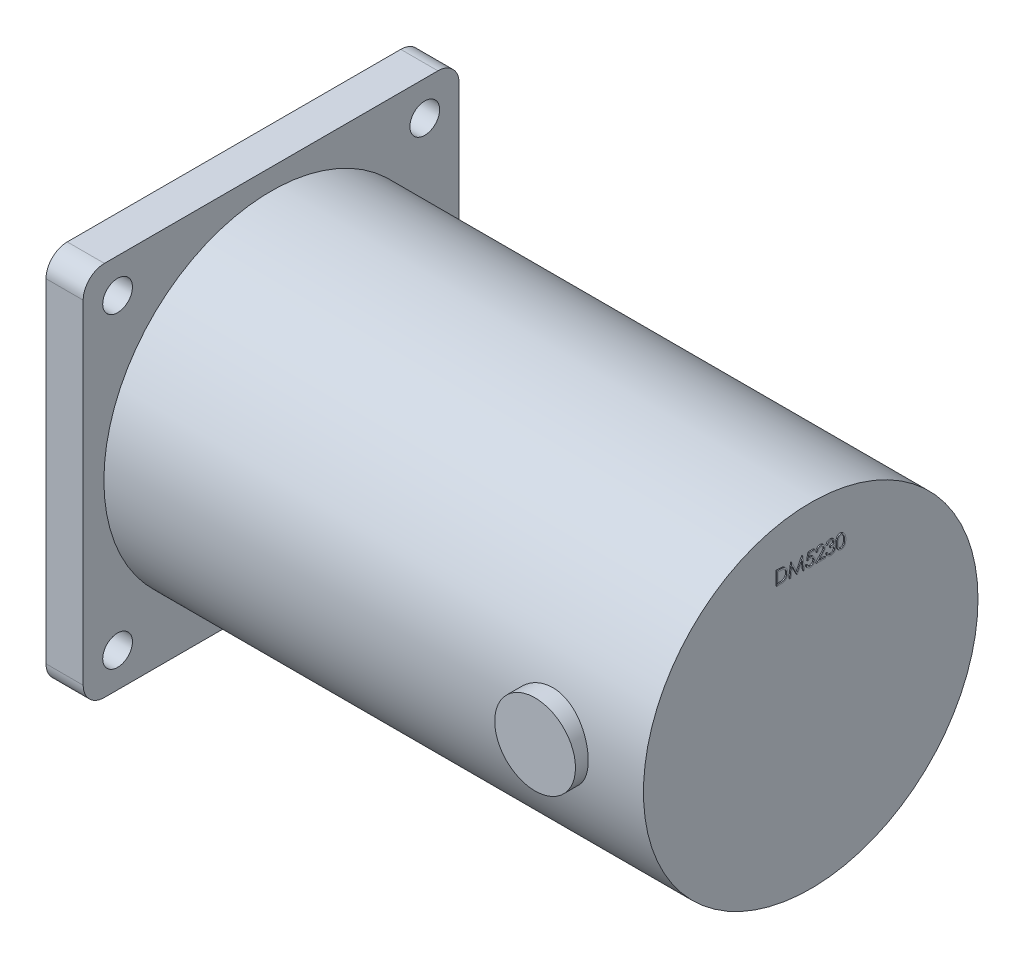
from build123d import *

# Parameters (mm, degrees)
SKETCH1_R           = 40.005
BOSS_EXTRUDE1_DEPTH = 129.032
SKETCH2_W           = 89.916
SKETCH2_H           = 89.916
BOSS_EXTRUDE2_DEPTH = 8.89
FILLET1_R           = 5.08
SKETCH3_R           = 41.529
BOSS_EXTRUDE3_DEPTH = 2
CUT_EXTRUDE4_REACH  = 153.871
SKETCH4_R           = 3.556
CIRPATTERN1_COUNT   = 4
SKETCH6_R           = 5
BOSS_EXTRUDE4_DEPTH = 29.5
BOSS_EXTRUDE5_DEPTH = 4
SKETCH8_R           = 9.652
BOSS_EXTRUDE6_DEPTH = 3.048
BOSS_EXTRUDE7_DEPTH = 0.254


with BuildPart() as part:
    # Sketch1 → Boss-Extrude1 (new body)
    with BuildSketch(Plane(origin=(0, 0, 0), x_dir=(0, 0, -1), z_dir=(1, 0, 0))):
        Circle(SKETCH1_R)
    extrude(amount=-BOSS_EXTRUDE1_DEPTH)

    # Sketch2 → Boss-Extrude2 (add)
    with BuildSketch(Plane.ZY.offset(129.032)):
        Rectangle(SKETCH2_W, SKETCH2_H)
    extrude(amount=BOSS_EXTRUDE2_DEPTH)

    # Fillet1
    fillet1_edges = [part.edges().sort_by_distance(p)[0] for p in [
        (-133.477, -44.958, 44.958),
        (-133.477, 44.958, 44.958),
        (-133.477, 44.958, -44.958),
        (-133.477, -44.958, -44.958),
    ]]
    fillet(fillet1_edges, radius=FILLET1_R)

    # Sketch3 → Boss-Extrude3 (add)
    with BuildSketch(Plane.ZY.offset(137.922)):
        Circle(SKETCH3_R)
    extrude(amount=BOSS_EXTRUDE3_DEPTH)

    # Sketch4 → Cut-Extrude4 (cut, up to next)
    with BuildSketch(Plane.ZY.offset(137.922), mode=Mode.PRIVATE) as cut_extrude4_sk1:
        with Locations((36.729247535, 36.729247535)):
            Circle(SKETCH4_R)
    cut_extrude4_tool1 = extrude(cut_extrude4_sk1.sketch, amount=-CUT_EXTRUDE4_REACH, mode=Mode.PRIVATE) & part.part
    cut_extrude4 = cut_extrude4_tool1.solids().sort_by_distance((-137.922, 36.729248, 36.729248))[0]
    add(cut_extrude4, mode=Mode.SUBTRACT)

    # CirPattern1: Cut-Extrude4 ×4 about axis
    cirpattern1_axis = Axis((0, 0, 0), (1, 0, 0))
    for i in range(1, CIRPATTERN1_COUNT):
        add(cut_extrude4.rotate(cirpattern1_axis, i * 360 / CIRPATTERN1_COUNT), mode=Mode.SUBTRACT)

    # Sketch6 → Boss-Extrude4 (add)
    with BuildSketch(Plane.ZY.offset(139.922)):
        with Locations(Location((0, 0, 0), (0, 0, 180))):
            Circle(SKETCH6_R)
    extrude(amount=BOSS_EXTRUDE4_DEPTH)

    # Sketch7 → Boss-Extrude5 (add)
    with BuildSketch(Plane(origin=(0, 2.660396, 0), x_dir=(1, 0, 0), z_dir=(0, 1, 0))):
        with BuildLine():
            Line((-169.422, 2.03121056), (-128.012686032, 2.03121056))
            ThreePointArc((-128.012686032, 2.03121056), (-135.661867848, -9.655707426), (-147.324, -1.96878944))
            Line((-147.324, -1.96878944), (-169.422, -1.96878944))
            Line((-169.422, -1.96878944), (-169.422, 2.03121056))
        make_face()
    extrude(amount=BOSS_EXTRUDE5_DEPTH)

    # Sketch8 → Boss-Extrude6 (add, symmetric)
    with BuildSketch(Plane.XY.offset(40.005)):
        with Locations((-22.86, 0)):
            Circle(SKETCH8_R)
    boss_extrude6 = extrude(amount=BOSS_EXTRUDE6_DEPTH, both=True)

    # Mirror1: Boss-Extrude6 across plane
    add(boss_extrude6.mirror(Plane.XY))

    # Sketch10 → Boss-Extrude7 (add)
    # profile 1 of 6: a face of its own
    with BuildSketch(Plane(origin=(0, 0, 0), x_dir=(0, 0, -1), z_dir=(1, 0, 0))):
        with BuildLine():
            Line((-8.336390827, 26.927418213), (-8.336390827, 30.102418213))
            Line((-8.336390827, 30.102418213), (-7.695285057, 30.102418213))
            add(Edge.make_bspline(
                [(-7.695285057, 30.102418213), (-7.639523904, 30.102016739), (-7.531793645, 30.101241093), (-7.376116639, 30.096323116), (-7.232077083, 30.087623194), (-7.100148704, 30.074950838), (-6.979969319, 30.059390586), (-6.871875439, 30.039886648), (-6.775308138, 30.01685595), (-6.715918002, 29.997220435), (-6.687833134, 29.98793504)],
                knots=[0, 0, 0, 0, 1.314313732, 2.53924729, 3.670748893, 4.714932338, 5.66265055, 6.526160246, 7.303039223, 8, 8, 8, 8], degree=3))
            add(Edge.make_bspline(
                [(-6.687833134, 29.98793504), (-6.651098621, 29.973937186), (-6.578462611, 29.946258902), (-6.475041864, 29.894047114), (-6.377682427, 29.834889515), (-6.285862203, 29.768708125), (-6.201678596, 29.693629037), (-6.121842861, 29.612841538), (-6.049620933, 29.52340783), (-5.983482693, 29.427182662), (-5.923851059, 29.325299586), (-5.872017681, 29.217952737), (-5.828970129, 29.10568727), (-5.793234845, 28.988815386), (-5.765071273, 28.8670801), (-5.745856235, 28.740339665), (-5.733182551, 28.609094971), (-5.731908876, 28.520036708), (-5.731262622, 28.474849102)],
                knots=[0, 0, 0, 0, 0.984719456, 1.947108742, 2.898477687, 3.838006223, 4.779231079, 5.722358779, 6.681677486, 7.655904652, 8.64651281, 9.637519902, 10.640069247, 11.656948941, 12.698408672, 13.768548281, 14.867775369, 16, 16, 16, 16], degree=3))
            add(Edge.make_bspline(
                [(-5.731262622, 28.474849102), (-5.731833185, 28.435604979), (-5.73295754, 28.358270335), (-5.743053419, 28.244296094), (-5.757727652, 28.133703068), (-5.780446317, 28.027017897), (-5.80802574, 27.923305871), (-5.843371792, 27.823672335), (-5.883862563, 27.727203308), (-5.931079239, 27.635203169), (-5.982914638, 27.548041825), (-6.038542219, 27.465876881), (-6.09790265, 27.389880787), (-6.161561974, 27.319823403), (-6.228697546, 27.255810343), (-6.299748903, 27.197306872), (-6.374899385, 27.145457711), (-6.453812397, 27.098225406), (-6.538790029, 27.057022655), (-6.63144185, 27.022161146), (-6.73216299, 26.993271716), (-6.840706223, 26.969168118), (-6.957259092, 26.950047994), (-7.081935868, 26.937233338), (-7.214544995, 26.928567463), (-7.305603328, 26.927808735), (-7.352471556, 26.927418213)],
                knots=[0, 0, 0, 0, 1.105936401, 2.179363191, 3.223086493, 4.248585256, 5.251745608, 6.245858792, 7.225916811, 8.198733463, 9.158002045, 10.082870192, 10.993790845, 11.873723703, 12.748670949, 13.606408763, 14.465103618, 15.319838547, 16.196477973, 17.123216899, 18.106603292, 19.147568657, 20.255746949, 21.433717677, 22.679120308, 24, 24, 24, 24], degree=3))
            Line((-7.352471556, 26.927418213), (-8.336390827, 26.927418213))
        make_face()
        with BuildLine():
            Line((-8.051454929, 27.253059239), (-7.687016828, 27.253059239))
            add(Edge.make_bspline(
                [(-7.687016828, 27.253059239), (-7.634648949, 27.253284298), (-7.533926339, 27.253717168), (-7.389093727, 27.25751556), (-7.256760275, 27.263722174), (-7.136907191, 27.272408138), (-7.029602148, 27.283900381), (-6.934620889, 27.296713686), (-6.852274762, 27.312677088), (-6.802445915, 27.327146887), (-6.779419673, 27.333833477)],
                knots=[0, 0, 0, 0, 1.375205317, 2.645023457, 3.804390687, 4.853969522, 5.800190428, 6.637939096, 7.370582563, 8, 8, 8, 8], degree=3))
            add(Edge.make_bspline(
                [(-6.779419673, 27.333833477), (-6.750437944, 27.344040248), (-6.693166715, 27.364210001), (-6.610724588, 27.401001594), (-6.533837877, 27.444582614), (-6.46116664, 27.493026105), (-6.393741745, 27.548040693), (-6.330764154, 27.60843009), (-6.272360663, 27.674501636), (-6.219134683, 27.746173325), (-6.17150215, 27.822999069), (-6.130253249, 27.904223582), (-6.094102217, 27.988956903), (-6.065728065, 28.078500211), (-6.043488928, 28.172053), (-6.027736675, 28.26962185), (-6.017926175, 28.371188542), (-6.016781862, 28.440269397), (-6.016198519, 28.47548512)],
                knots=[0, 0, 0, 0, 0.998632004, 1.973411704, 2.929992603, 3.868527914, 4.809262121, 5.754881198, 6.702106254, 7.672490631, 8.653608572, 9.636854334, 10.631411391, 11.644891563, 12.686317036, 13.754757253, 14.855430412, 16, 16, 16, 16], degree=3))
            add(Edge.make_bspline(
                [(-6.016198519, 28.47548512), (-6.016664144, 28.512617634), (-6.017578868, 28.585564787), (-6.029076278, 28.692599204), (-6.045877975, 28.795542365), (-6.070174605, 28.894401157), (-6.101136188, 28.989368448), (-6.139775613, 29.079919003), (-6.183923189, 29.167009134), (-6.236449787, 29.248628738), (-6.29397679, 29.325820344), (-6.35781958, 29.396536589), (-6.426963858, 29.460938561), (-6.500655471, 29.520029223), (-6.580971269, 29.571431272), (-6.66601926, 29.617411333), (-6.757047118, 29.656432891), (-6.820377207, 29.677187288), (-6.8525617, 29.687734719)],
                knots=[0, 0, 0, 0, 1.122418816, 2.205001699, 3.251619955, 4.274784885, 5.280384055, 6.268708349, 7.249350384, 8.229342522, 9.199999885, 10.157847722, 11.105861043, 12.055065948, 13.010012805, 13.98527497, 14.976112212, 16, 16, 16, 16], degree=3))
            add(Edge.make_bspline(
                [(-6.8525617, 29.687734719), (-6.879187383, 29.695097479), (-6.93580089, 29.710752726), (-7.028183832, 29.727830028), (-7.132156146, 29.742892681), (-7.248179447, 29.755645331), (-7.376121477, 29.764795972), (-7.516080637, 29.771664236), (-7.668117421, 29.776296681), (-7.773511577, 29.776613009), (-7.828212742, 29.776777187)],
                knots=[0, 0, 0, 0, 0.674548936, 1.434276114, 2.292660221, 3.240891867, 4.284742987, 5.42552168, 6.663806718, 8, 8, 8, 8], degree=3))
            Line((-7.828212742, 29.776777187), (-8.051454929, 29.776777187))
            Line((-8.051454929, 29.776777187), (-8.051454929, 27.253059239))
        make_face(mode=Mode.SUBTRACT)
    # profile 2 of 6: a face of its own
    with BuildSketch(Plane(origin=(0, 0, 0), x_dir=(0, 0, -1), z_dir=(1, 0, 0))):
        Polygon((-5.242801083, 26.927418213), (-4.823665466, 30.102418213), (-4.782960338, 30.102418213), (-3.472128006, 27.497290008), (-2.164475763, 30.102418213), (-2.123134617, 30.102418213), (-1.701454929, 26.927418213), (-1.987662862, 26.927418213), (-2.291679288, 29.211993534), (-3.437783054, 26.927418213), (-3.502020835, 26.927418213), (-4.652576724, 29.217081675), (-4.955957133, 26.927418213), align=None)
    # profile 3 of 6: a face of its own
    with BuildSketch(Plane(origin=(0, 0, 0), x_dir=(0, 0, -1), z_dir=(1, 0, 0))):
        with BuildLine():
            Line((0.659442507, 30.102418213), (0.659442507, 29.776777187))
            Line((0.659442507, 29.776777187), (-0.420515426, 29.776777187))
            Line((-0.420515426, 29.776777187), (-0.591604168, 28.941686042))
            add(Edge.make_bspline(
                [(-0.591604168, 28.941686042), (-0.557989196, 28.95096636), (-0.492865505, 28.968945508), (-0.396744774, 28.988907885), (-0.305493275, 29.000941538), (-0.246279189, 29.002584656), (-0.217625803, 29.003379751)],
                knots=[0, 0, 0, 0, 1.100273476, 2.13160584, 3.095893838, 4, 4, 4, 4], degree=3))
            add(Edge.make_bspline(
                [(-0.217625803, 29.003379751), (-0.182171267, 29.002612367), (-0.112458793, 29.001103497), (-0.010460605, 28.986614748), (0.086905662, 28.963809254), (0.179436384, 28.931949924), (0.267302741, 28.89121038), (0.349696314, 28.84031972), (0.42785385, 28.780871627), (0.500373203, 28.712522937), (0.566163111, 28.637301185), (0.624007973, 28.556422259), (0.67314118, 28.470672165), (0.712657007, 28.379231613), (0.744211368, 28.283111524), (0.765213535, 28.181300538), (0.779198692, 28.074758315), (0.780761142, 28.001910598), (0.781557891, 27.964762965)],
                knots=[0, 0, 0, 0, 1.052922333, 2.070308379, 3.05430497, 4.020497103, 4.973039431, 5.925935799, 6.892292201, 7.88610001, 8.88166317, 9.857072816, 10.836096531, 11.812156883, 12.81219415, 13.836441305, 14.89672472, 16, 16, 16, 16], degree=3))
            add(Edge.make_bspline(
                [(0.781557891, 27.964762965), (0.780954573, 27.938889236), (0.77975609, 27.88749144), (0.773661371, 27.81116063), (0.761926829, 27.736445774), (0.746171822, 27.663336961), (0.725722628, 27.591972602), (0.700967558, 27.522148431), (0.67067259, 27.454299037), (0.6374427, 27.387782429), (0.600026252, 27.324102355), (0.558498606, 27.264549345), (0.514624196, 27.208230033), (0.467415225, 27.155748432), (0.416432894, 27.107449409), (0.362294638, 27.063046325), (0.305432457, 27.021788261), (0.24496663, 26.98534997), (0.182244521, 26.951819288), (0.116360352, 26.924311508), (0.04881386, 26.899718386), (-0.021367135, 26.880115457), (-0.094023665, 26.864755211), (-0.169275497, 26.854322524), (-0.246727962, 26.846723898), (-0.299228866, 26.846248231), (-0.325748799, 26.846007957)],
                knots=[0, 0, 0, 0, 1.056347294, 2.098418968, 3.122841568, 4.141288669, 5.149314143, 6.15115421, 7.162517403, 8.180376062, 9.185164535, 10.17417709, 11.141909838, 12.097768115, 13.052685741, 14.0056014, 14.954263652, 15.917497458, 16.885230207, 17.854509472, 18.828990115, 19.81800267, 20.826176721, 21.857883937, 22.917946725, 24, 24, 24, 24], degree=3))
            add(Edge.make_bspline(
                [(-0.325748799, 26.846007957), (-0.357384663, 26.846634645), (-0.419624488, 26.847867581), (-0.510811003, 26.860765779), (-0.598544966, 26.87923876), (-0.68212013, 26.907030233), (-0.76228549, 26.941852994), (-0.837961813, 26.985864092), (-0.911082767, 27.035737993), (-0.978675829, 27.094593742), (-1.041410303, 27.158924396), (-1.09756835, 27.228735971), (-1.147582381, 27.302876251), (-1.19065148, 27.38170529), (-1.227388971, 27.465015958), (-1.25624971, 27.553120394), (-1.279543646, 27.645558255), (-1.289398321, 27.709197511), (-1.294403647, 27.741520777)],
                knots=[0, 0, 0, 0, 1.0467383, 2.05933395, 3.04377827, 4.011590433, 4.970194871, 5.932262533, 6.905835911, 7.896367577, 8.894135286, 9.877477877, 10.858688626, 11.851381753, 12.8477658, 13.868841284, 14.917554742, 16, 16, 16, 16], degree=3))
            Line((-1.294403647, 27.741520777), (-1.00946775, 27.741520777))
            add(Edge.make_bspline(
                [(-1.00946775, 27.741520777), (-1.002456844, 27.711243567), (-0.988981494, 27.653049087), (-0.959403422, 27.571287085), (-0.923239378, 27.498426074), (-0.880236862, 27.433502238), (-0.828937906, 27.376888362), (-0.770400495, 27.326435742), (-0.704770775, 27.280919731), (-0.631842631, 27.242980507), (-0.554905052, 27.210623852), (-0.474380511, 27.189077672), (-0.392461568, 27.173927576), (-0.337054761, 27.17241105), (-0.309212341, 27.171648982)],
                knots=[0, 0, 0, 0, 1.136247022, 2.183929868, 3.172523383, 4.106158343, 5.02341133, 5.958108904, 6.928429099, 7.938127109, 8.96079061, 9.975095812, 10.982467395, 12, 12, 12, 12], degree=3))
            add(Edge.make_bspline(
                [(-0.309212341, 27.171648982), (-0.282035752, 27.172393545), (-0.228524826, 27.173859595), (-0.149774497, 27.185143556), (-0.073744247, 27.20252221), (-0.001184287, 27.228529864), (0.069175109, 27.260139002), (0.135554172, 27.300701963), (0.199873211, 27.347383552), (0.260133018, 27.400865637), (0.31532309, 27.459802432), (0.364087571, 27.522828353), (0.404706628, 27.590062921), (0.438936855, 27.660342138), (0.464929491, 27.734436258), (0.483472381, 27.811998038), (0.49436087, 27.893219056), (0.495858726, 27.948617644), (0.496621994, 27.9768473)],
                knots=[0, 0, 0, 0, 1.027316725, 2.022795036, 3.002884548, 3.971462791, 4.93288096, 5.914575861, 6.907176829, 7.935150275, 8.956128384, 9.956726525, 10.942570165, 11.921478529, 12.907843606, 13.90538589, 14.932640048, 16, 16, 16, 16], degree=3))
            add(Edge.make_bspline(
                [(0.496621994, 27.9768473), (0.496024659, 28.002316017), (0.494855461, 28.052167408), (0.485302729, 28.125100974), (0.468686619, 28.194110091), (0.445623527, 28.259528003), (0.416341403, 28.321416411), (0.380557962, 28.379839187), (0.337601665, 28.434026308), (0.288532595, 28.484003124), (0.234777086, 28.530126689), (0.175410263, 28.569445967), (0.111674472, 28.60252395), (0.044337621, 28.63106992), (-0.028201965, 28.651572025), (-0.104507768, 28.666964321), (-0.185403781, 28.675868257), (-0.240712906, 28.677103684), (-0.26914323, 28.677738726)],
                knots=[0, 0, 0, 0, 1.045622112, 2.046656509, 3.013763289, 3.955457236, 4.890082067, 5.820317437, 6.762574623, 7.722996705, 8.69280354, 9.665887285, 10.63943826, 11.638615906, 12.663482002, 13.728887084, 14.832589034, 16, 16, 16, 16], degree=3))
            add(Edge.make_bspline(
                [(-0.26914323, 28.677738726), (-0.293753044, 28.677212047), (-0.344566067, 28.676124588), (-0.422510345, 28.668117694), (-0.504417837, 28.65520062), (-0.589974558, 28.637433096), (-0.679437447, 28.614182047), (-0.772617711, 28.586319608), (-0.869711267, 28.553007509), (-0.935132346, 28.527850429), (-0.968762622, 28.514918213)],
                knots=[0, 0, 0, 0, 0.817624296, 1.688186739, 2.600797293, 3.572016777, 4.590301741, 5.671205678, 6.80286297, 8, 8, 8, 8], degree=3))
            Line((-0.968762622, 28.514918213), (-0.643121596, 30.102418213))
            Line((-0.643121596, 30.102418213), (0.659442507, 30.102418213))
        make_face()
    # profile 4 of 6: a face of its own
    with BuildSketch(Plane(origin=(0, 0, 0), x_dir=(0, 0, -1), z_dir=(1, 0, 0))):
        with BuildLine():
            Line((1.514250199, 29.125495136), (1.229314302, 29.125495136))
            add(Edge.make_bspline(
                [(1.229314302, 29.125495136), (1.231171362, 29.163296584), (1.234818579, 29.237537622), (1.251898527, 29.345781452), (1.276337751, 29.449245448), (1.310892142, 29.54709887), (1.353805693, 29.640206931), (1.405267933, 29.728199802), (1.466222354, 29.810741809), (1.535352749, 29.88706776), (1.610435728, 29.957087913), (1.691448973, 30.017553741), (1.77657982, 30.068641914), (1.865569989, 30.111351326), (1.9594235, 30.143409615), (2.057288664, 30.167196388), (2.159595452, 30.181507787), (2.229300329, 30.183046107), (2.264751, 30.183828469)],
                knots=[0, 0, 0, 0, 1.10065271, 2.161652631, 3.183658789, 4.190468796, 5.17591951, 6.163126047, 7.15150782, 8.156236427, 9.156009102, 10.134482811, 11.092018607, 12.041330605, 13.001268258, 13.972401359, 14.968799086, 16, 16, 16, 16], degree=3))
            add(Edge.make_bspline(
                [(2.264751, 30.183828469), (2.299565396, 30.183013441), (2.36797444, 30.181411939), (2.46781641, 30.16765872), (2.562864385, 30.146118076), (2.652932573, 30.115896234), (2.73730236, 30.075270361), (2.81660755, 30.026468308), (2.891792286, 29.970026032), (2.959471297, 29.903574359), (3.021617912, 29.832633624), (3.0752321, 29.756898169), (3.12114547, 29.678675888), (3.159415722, 29.597370305), (3.187588077, 29.512215872), (3.20897688, 29.424452338), (3.221066748, 29.33317126), (3.222922239, 29.271388884), (3.223865584, 29.239978309)],
                knots=[0, 0, 0, 0, 1.111607364, 2.184268762, 3.212621178, 4.221274766, 5.211760367, 6.196651075, 7.1921475, 8.207485113, 9.220403448, 10.201281604, 11.166441695, 12.114753415, 13.065576456, 14.026450734, 14.996634279, 16, 16, 16, 16], degree=3))
            add(Edge.make_bspline(
                [(3.223865584, 29.239978309), (3.222329552, 29.195757059), (3.219284445, 29.10809058), (3.193236403, 28.979262811), (3.152554211, 28.854445924), (3.103570894, 28.753991371), (3.054156606, 28.673043845), (3.009627224, 28.606397234), (2.957498431, 28.534637273), (2.897011508, 28.45800426), (2.829417688, 28.375897939), (2.754104726, 28.288367911), (2.670535567, 28.196318519), (2.61188107, 28.133448438), (2.581487779, 28.100870737)],
                knots=[0, 0, 0, 0, 1.184426356, 2.348067706, 3.509069118, 4.696110526, 5.333549288, 6.050745305, 6.844228056, 7.710549037, 8.667450064, 9.695053472, 10.805634456, 12, 12, 12, 12], degree=3))
            Line((2.581487779, 28.100870737), (1.787101761, 27.253059239))
            Line((1.787101761, 27.253059239), (3.264570712, 27.253059239))
            Line((3.264570712, 27.253059239), (3.264570712, 26.927418213))
            Line((3.264570712, 26.927418213), (1.107198917, 26.927418213))
            Line((1.107198917, 26.927418213), (2.338529045, 28.241430633))
            add(Edge.make_bspline(
                [(2.338529045, 28.241430633), (2.3685082, 28.272725525), (2.42609202, 28.332836609), (2.507537643, 28.420596294), (2.580688725, 28.502011949), (2.646018789, 28.576929746), (2.702110612, 28.646445526), (2.751887565, 28.708307864), (2.791770637, 28.765235115), (2.835055317, 28.831221244), (2.876978, 28.911786703), (2.91300278, 29.010242264), (2.934969107, 29.111594843), (2.937604208, 29.180085977), (2.938929686, 29.214537604)],
                knots=[0, 0, 0, 0, 1.329631726, 2.553950428, 3.673215718, 4.687767853, 5.603093632, 6.413772471, 7.123043292, 7.734684054, 8.834405432, 9.900288307, 10.943827018, 12, 12, 12, 12], degree=3))
            add(Edge.make_bspline(
                [(2.938929686, 29.214537604), (2.938352977, 29.236201444), (2.937216394, 29.278896713), (2.927185483, 29.341494794), (2.912026667, 29.401878589), (2.890304897, 29.460233837), (2.861633068, 29.515973821), (2.826732217, 29.569166392), (2.786464088, 29.620591382), (2.73988115, 29.668809017), (2.688707843, 29.712969825), (2.634647345, 29.752089531), (2.577451894, 29.784782153), (2.51736264, 29.811582325), (2.454547107, 29.832605707), (2.388883802, 29.847173132), (2.320554159, 29.856319386), (2.273896631, 29.857556884), (2.250122595, 29.858187444)],
                knots=[0, 0, 0, 0, 0.991446411, 1.95395049, 2.89581595, 3.838931463, 4.798493298, 5.75982156, 6.748411868, 7.785213223, 8.824556874, 9.840280684, 10.836137867, 11.835679398, 12.848801643, 13.863922112, 14.911575587, 16, 16, 16, 16], degree=3))
            add(Edge.make_bspline(
                [(2.250122595, 29.858187444), (2.225293339, 29.857538807), (2.176532781, 29.856264993), (2.104941944, 29.847354433), (2.036646989, 29.831982135), (1.97147612, 29.81095758), (1.909319067, 29.784234468), (1.850478113, 29.750949814), (1.795085349, 29.711231931), (1.743036646, 29.666200855), (1.695081465, 29.616065245), (1.652947513, 29.560176207), (1.616132014, 29.499554195), (1.584010781, 29.434362781), (1.557925262, 29.364010424), (1.537992476, 29.288746863), (1.522220122, 29.208898895), (1.516950964, 29.15375814), (1.514250199, 29.125495136)],
                knots=[0, 0, 0, 0, 1.031018746, 2.02475058, 2.990194455, 3.934040569, 4.864654155, 5.795059489, 6.735614925, 7.690564532, 8.649604399, 9.611025574, 10.590972636, 11.591080095, 12.624614302, 13.701020113, 14.821632451, 16, 16, 16, 16], degree=3))
        make_face()
    # profile 5 of 6: a face of its own
    with BuildSketch(Plane(origin=(0, 0, 0), x_dir=(0, 0, -1), z_dir=(1, 0, 0))):
        with BuildLine():
            Line((3.956557891, 29.369725905), (3.671621994, 29.369725905))
            add(Edge.make_bspline(
                [(3.671621994, 29.369725905), (3.679341372, 29.401686801), (3.694432125, 29.464167739), (3.725907781, 29.553437183), (3.760197105, 29.63791352), (3.801371507, 29.716014959), (3.84628302, 29.789311106), (3.897738632, 29.856139526), (3.95336438, 29.918199859), (4.014891298, 29.973275439), (4.079415156, 30.023148093), (4.147845132, 30.065670467), (4.218804471, 30.102250234), (4.292784813, 30.13238573), (4.370006412, 30.155087455), (4.449771142, 30.171558272), (4.532288031, 30.182254497), (4.588301917, 30.183298403), (4.616744189, 30.183828469)],
                knots=[0, 0, 0, 0, 1.162005537, 2.271625781, 3.343758855, 4.383309926, 5.390229558, 6.379919256, 7.361854164, 8.333198761, 9.295911338, 10.242430842, 11.177959212, 12.116337295, 13.062827104, 14.020064771, 14.994644689, 16, 16, 16, 16], degree=3))
            add(Edge.make_bspline(
                [(4.616744189, 30.183828469), (4.658184963, 30.182577311), (4.740162565, 30.180102284), (4.860597615, 30.157501331), (4.97673623, 30.121737104), (5.08730719, 30.072321651), (5.190012482, 30.01137316), (5.281394595, 29.93883372), (5.360214887, 29.856102925), (5.426340501, 29.764724099), (5.478115678, 29.667065173), (5.516294032, 29.566553602), (5.539536556, 29.463427813), (5.542548776, 29.393797996), (5.544057891, 29.358913606)],
                knots=[0, 0, 0, 0, 1.083050992, 2.142477498, 3.193116406, 4.255571735, 5.30263384, 6.308962982, 7.297363603, 8.282367274, 9.249857812, 10.179914175, 11.08814088, 12, 12, 12, 12], degree=3))
            add(Edge.make_bspline(
                [(5.544057891, 29.358913606), (5.543002348, 29.325343156), (5.540936814, 29.259650996), (5.523398381, 29.163746495), (5.493883342, 29.073357329), (5.452998629, 28.988102989), (5.400074508, 28.908524027), (5.335964276, 28.834441398), (5.260215433, 28.765526519), (5.202812396, 28.72604814), (5.173259614, 28.705723501)],
                knots=[0, 0, 0, 0, 1.024540389, 2.004866551, 2.965041327, 3.920577974, 4.882998113, 5.874504559, 6.905732034, 8, 8, 8, 8], degree=3))
            add(Edge.make_bspline(
                [(5.173259614, 28.705723501), (5.207034134, 28.689414732), (5.273951227, 28.657102341), (5.365164922, 28.59373319), (5.447966995, 28.520566361), (5.49414394, 28.463468383), (5.517345151, 28.434779992)],
                knots=[0, 0, 0, 0, 1.015518401, 2.012035669, 3.001164323, 4, 4, 4, 4], degree=3))
            add(Edge.make_bspline(
                [(5.517345151, 28.434779992), (5.532622654, 28.413863317), (5.562927481, 28.372372493), (5.600334001, 28.305664449), (5.634269412, 28.238217027), (5.660712825, 28.168222423), (5.681190548, 28.096491903), (5.695828234, 28.022902301), (5.704921562, 27.947393524), (5.706223812, 27.89631006), (5.706878404, 27.870632356)],
                knots=[0, 0, 0, 0, 1.025084078, 2.033381695, 3.024893161, 4.013698104, 4.991890475, 5.976764909, 6.982997093, 8, 8, 8, 8], degree=3))
            add(Edge.make_bspline(
                [(5.706878404, 27.870632356), (5.705250524, 27.826173537), (5.702002425, 27.737465124), (5.672970157, 27.606405912), (5.62796386, 27.478294207), (5.564049354, 27.355762031), (5.486155257, 27.241116971), (5.39348397, 27.138540605), (5.287088442, 27.050367585), (5.168429032, 26.976698307), (5.039871351, 26.917808478), (4.902370636, 26.87693494), (4.757908087, 26.850313926), (4.658841467, 26.847459267), (4.60847596, 26.846007957)],
                knots=[0, 0, 0, 0, 0.955779014, 1.907060117, 2.875433937, 3.871313158, 4.872415639, 5.851225146, 6.836215519, 7.83643374, 8.849228613, 9.86973379, 10.916971861, 12, 12, 12, 12], degree=3))
            add(Edge.make_bspline(
                [(4.60847596, 26.846007957), (4.574531309, 26.84679555), (4.507739555, 26.848345271), (4.409547239, 26.858939431), (4.315819697, 26.878288793), (4.226430205, 26.904326791), (4.141299351, 26.9373393), (4.060686912, 26.978449833), (3.984096938, 27.026810982), (3.912252175, 27.082993594), (3.845161188, 27.145841666), (3.784606931, 27.216470911), (3.729579833, 27.293575699), (3.681553297, 27.378051614), (3.638339776, 27.468806954), (3.602797051, 27.567003807), (3.571513713, 27.671764312), (3.556969071, 27.744769119), (3.549506609, 27.782225905)],
                knots=[0, 0, 0, 0, 1.048658725, 2.063410685, 3.046034179, 4.001477787, 4.936774919, 5.862367409, 6.792675028, 7.730719943, 8.675894397, 9.627829632, 10.600096036, 11.597688215, 12.626045268, 13.701542398, 14.82072376, 16, 16, 16, 16], degree=3))
            Line((3.549506609, 27.782225905), (3.834442507, 27.782225905))
            add(Edge.make_bspline(
                [(3.834442507, 27.782225905), (3.841865921, 27.7577793), (3.856305107, 27.71022853), (3.880883506, 27.641793396), (3.908885438, 27.579057162), (3.938925074, 27.521559616), (3.970474093, 27.468734508), (4.005775489, 27.421978669), (4.042214642, 27.37923845), (4.069682341, 27.355158695), (4.083125399, 27.343373742)],
                knots=[0, 0, 0, 0, 1.198163088, 2.33053128, 3.407730985, 4.417276592, 5.372219308, 6.28897303, 7.162600585, 8, 8, 8, 8], degree=3))
            add(Edge.make_bspline(
                [(4.083125399, 27.343373742), (4.100902294, 27.329668325), (4.136401209, 27.302299796), (4.194248105, 27.267373319), (4.255085537, 27.237110103), (4.320231706, 27.21399275), (4.388280819, 27.194418729), (4.460332786, 27.181609401), (4.535751933, 27.172820846), (4.587248404, 27.172045301), (4.613564101, 27.171648982)],
                knots=[0, 0, 0, 0, 0.946170439, 1.889420265, 2.845303464, 3.807233317, 4.801018734, 5.828864929, 6.890507805, 8, 8, 8, 8], degree=3))
            add(Edge.make_bspline(
                [(4.613564101, 27.171648982), (4.643276207, 27.172207696), (4.701375665, 27.173300213), (4.786152574, 27.183347462), (4.86680433, 27.197980051), (4.942435484, 27.220579685), (5.01403673, 27.248502315), (5.080604369, 27.28356194), (5.143012265, 27.32469608), (5.200461083, 27.37144946), (5.252118793, 27.422631816), (5.297602495, 27.476165102), (5.336269152, 27.531823605), (5.367459969, 27.589915329), (5.392089397, 27.650199715), (5.4088563, 27.712845939), (5.420514461, 27.777341316), (5.421463887, 27.821182595), (5.421942507, 27.843283598)],
                knots=[0, 0, 0, 0, 1.217147791, 2.380027433, 3.494444702, 4.572153297, 5.609568379, 6.639424714, 7.649109417, 8.668170816, 9.669597737, 10.625200337, 11.543417969, 12.441394052, 13.322311151, 14.205496177, 15.095365482, 16, 16, 16, 16], degree=3))
            add(Edge.make_bspline(
                [(5.421942507, 27.843283598), (5.420554305, 27.872866741), (5.417784808, 27.931885825), (5.396640597, 28.018715339), (5.36186177, 28.102375149), (5.313173134, 28.181437901), (5.253904295, 28.254713184), (5.184630415, 28.320092314), (5.104776237, 28.374040182), (5.031279641, 28.411313464), (4.966178392, 28.436747096), (4.910465865, 28.453687957), (4.848093803, 28.468033201), (4.779816472, 28.481379333), (4.705119412, 28.492737985), (4.624083943, 28.502210204), (4.536693645, 28.509789419), (4.47619523, 28.513174056), (4.44501943, 28.514918213)],
                knots=[0, 0, 0, 0, 1.07054697, 2.135767047, 3.216561865, 4.33974944, 5.486079747, 6.621378074, 7.775625952, 8.963672916, 9.598146892, 10.304877434, 11.070270905, 11.915000392, 12.823868403, 13.805723172, 14.86925407, 16, 16, 16, 16], degree=3))
            Line((4.44501943, 28.514918213), (4.44501943, 28.840559239))
            add(Edge.make_bspline(
                [(4.44501943, 28.840559239), (4.484299773, 28.841225811), (4.561240316, 28.842531461), (4.67363015, 28.858323014), (4.781102368, 28.880167583), (4.881275199, 28.913627722), (4.97257796, 28.952489991), (5.051789313, 28.997713067), (5.117799511, 29.047982161), (5.170287769, 29.104073171), (5.209774998, 29.164230393), (5.23864645, 29.226929075), (5.255701031, 29.292718759), (5.257977658, 29.337617493), (5.259121994, 29.360185641)],
                knots=[0, 0, 0, 0, 1.321986639, 2.589447074, 3.816329219, 5.01088745, 6.139805852, 7.153945165, 8.075214402, 8.924034688, 9.728124013, 10.488707548, 11.240355623, 12, 12, 12, 12], degree=3))
            add(Edge.make_bspline(
                [(5.259121994, 29.360185641), (5.258746064, 29.376766167), (5.257998169, 29.409752337), (5.248566353, 29.457944363), (5.234393116, 29.504663079), (5.214907933, 29.549709807), (5.188827395, 29.592772126), (5.15761625, 29.634217169), (5.120452331, 29.673808312), (5.077866104, 29.710711173), (5.032135395, 29.74588041), (4.982015956, 29.77573778), (4.92901897, 29.801269372), (4.873085762, 29.822323706), (4.814034816, 29.838161775), (4.752143582, 29.849533574), (4.68729404, 29.856643447), (4.643051112, 29.857667081), (4.620560295, 29.858187444)],
                knots=[0, 0, 0, 0, 0.884392785, 1.759457502, 2.611959086, 3.489218968, 4.37281399, 5.2945488, 6.255912374, 7.266815255, 8.301784654, 9.332968512, 10.37626691, 11.440494194, 12.520033166, 13.637162961, 14.798855837, 16, 16, 16, 16], degree=3))
            add(Edge.make_bspline(
                [(4.620560295, 29.858187444), (4.584409139, 29.85692528), (4.513797523, 29.85445998), (4.412002563, 29.832867246), (4.317370024, 29.798415699), (4.245035663, 29.757292174), (4.191620756, 29.716697138), (4.153450962, 29.68124383), (4.115967356, 29.641844054), (4.081635921, 29.5960711), (4.046915956, 29.547024797), (4.015306961, 29.492211886), (3.984591383, 29.433062185), (3.966083356, 29.39124686), (3.956557891, 29.369725905)],
                knots=[0, 0, 0, 0, 1.472543308, 2.876219568, 4.221790263, 5.565193594, 6.249813518, 6.953379497, 7.687249741, 8.463570142, 9.283606569, 10.136032583, 11.040678096, 12, 12, 12, 12], degree=3))
        make_face()
    # profile 6 of 6: a face of its own
    with BuildSketch(Plane(origin=(0, 0, 0), x_dir=(0, 0, -1), z_dir=(1, 0, 0))):
        with BuildLine():
            add(Edge.make_bspline(
                [(5.991814302, 28.513646178), (5.992111861, 28.564534522), (5.992689874, 28.663385865), (5.999120085, 28.807426219), (6.009802002, 28.942554481), (6.024440905, 29.06877712), (6.042255358, 29.18612672), (6.06603655, 29.294289679), (6.093081021, 29.393766607), (6.124425025, 29.484881894), (6.159792519, 29.568863096), (6.198286456, 29.6472631), (6.241434519, 29.719963282), (6.286770719, 29.788123992), (6.336130241, 29.850629486), (6.38810843, 29.908362473), (6.444733989, 29.959988654), (6.504082003, 30.007020657), (6.566689796, 30.04824982), (6.630772786, 30.084565233), (6.696772061, 30.115589398), (6.764867812, 30.139982865), (6.83444799, 30.160131276), (6.905755829, 30.173909822), (6.978909066, 30.182579303), (7.028286153, 30.18340813), (7.053327723, 30.183828469)],
                knots=[0, 0, 0, 0, 1.646270934, 3.197905019, 4.663502075, 6.030701355, 7.308322542, 8.50163776, 9.611534131, 10.641858119, 11.616356847, 12.558055219, 13.465016945, 14.349605745, 15.204443733, 16.039544428, 16.859896111, 17.680448484, 18.487036065, 19.28249412, 20.06191084, 20.843045899, 21.620316918, 22.403196591, 23.190181807, 24, 24, 24, 24], degree=3))
            add(Edge.make_bspline(
                [(7.053327723, 30.183828469), (7.078578479, 30.183385951), (7.128794287, 30.182505922), (7.203035198, 30.174047774), (7.275560981, 30.160013256), (7.346062436, 30.1401278), (7.415118673, 30.115457436), (7.482189557, 30.084535551), (7.547691696, 30.04854115), (7.610584171, 30.006246633), (7.671557429, 29.959091282), (7.729113795, 29.905785147), (7.783258509, 29.846866473), (7.834671107, 29.78296564), (7.881892971, 29.712857027), (7.926863156, 29.637760013), (7.967114931, 29.5563613), (8.005881386, 29.470019018), (8.039343153, 29.376344128), (8.06952039, 29.275864667), (8.093903454, 29.167393797), (8.114213723, 29.051500632), (8.129948021, 28.927759558), (8.141407632, 28.796435829), (8.147461073, 28.657443046), (8.148601081, 28.562412711), (8.149186096, 28.513646178)],
                knots=[0, 0, 0, 0, 0.810914788, 1.612654377, 2.396697861, 3.181598691, 3.963628158, 4.749916497, 5.551656086, 6.361998678, 7.18212741, 8.025565596, 8.878627764, 9.750805457, 10.657531673, 11.591944965, 12.560506719, 13.57287815, 14.630710178, 15.753379473, 16.941251878, 18.199788006, 19.531962791, 20.947069417, 22.433333509, 24, 24, 24, 24], degree=3))
            add(Edge.make_bspline(
                [(8.149186096, 28.513646178), (8.148595016, 28.465092347), (8.14744332, 28.370487188), (8.141475494, 28.232119803), (8.129720164, 28.101493007), (8.115015389, 27.978293516), (8.094649158, 27.863034104), (8.069607329, 27.755315926), (8.041803107, 27.654673804), (8.007481544, 27.561932225), (7.969916114, 27.475797448), (7.929044614, 27.395363677), (7.885256987, 27.319919969), (7.837551482, 27.250070199), (7.786703029, 27.18531956), (7.73162332, 27.126811002), (7.673865004, 27.07313475), (7.612712312, 27.025372202), (7.548838977, 26.9835667), (7.483561814, 26.94617985), (7.415722602, 26.916033048), (7.346858709, 26.89014769), (7.27598512, 26.870371566), (7.20319018, 26.856697425), (7.128844166, 26.847107248), (7.078587032, 26.846375656), (7.053327723, 26.846007957)],
                knots=[0, 0, 0, 0, 1.561518951, 3.042555995, 4.452378317, 5.7783523, 7.031515105, 8.214008947, 9.334062868, 10.386615937, 11.391082383, 12.354592575, 13.286541444, 14.194233754, 15.072674879, 15.931287219, 16.775624067, 17.606195743, 18.42308326, 19.229000347, 20.022332153, 20.807536673, 21.593273796, 22.3848459, 23.188221202, 24, 24, 24, 24], degree=3))
            add(Edge.make_bspline(
                [(7.053327723, 26.846007957), (7.028286848, 26.846431008), (6.978911131, 26.847265182), (6.905747859, 26.855895495), (6.8347345, 26.869770702), (6.76552063, 26.889198621), (6.697751148, 26.912979223), (6.632349517, 26.943961493), (6.568588547, 26.979643112), (6.506638349, 27.020278959), (6.447663032, 27.066835057), (6.391330726, 27.118328376), (6.339056601, 27.176043899), (6.290402815, 27.239070301), (6.244162035, 27.306827742), (6.201626674, 27.380241338), (6.162283114, 27.459019992), (6.126320805, 27.543672668), (6.094435946, 27.635434638), (6.066271239, 27.735355679), (6.044033396, 27.84431772), (6.024998858, 27.961445617), (6.009646025, 28.087242683), (5.999164601, 28.22177721), (5.992686408, 28.364965364), (5.992110309, 28.463181516), (5.991814302, 28.513646178)],
                knots=[0, 0, 0, 0, 0.810891512, 1.598919785, 2.382837074, 3.152667961, 3.926044502, 4.706494248, 5.493654104, 6.291793342, 7.103789334, 7.925228297, 8.761435821, 9.622817696, 10.50288917, 11.416980706, 12.369136599, 13.353924996, 14.394355917, 15.514179734, 16.714354668, 17.994756427, 19.357759367, 20.818452758, 22.365282078, 24, 24, 24, 24], degree=3))
        make_face()
        with BuildLine():
            add(Edge.make_bspline(
                [(6.276750199, 28.514918213), (6.276858555, 28.472510465), (6.277068851, 28.390205353), (6.28256269, 28.27060468), (6.29004683, 28.159053025), (6.299700006, 28.055408745), (6.314035538, 27.960022663), (6.330098124, 27.872238736), (6.34964532, 27.792521528), (6.372772943, 27.720324014), (6.399115552, 27.65442093), (6.4278773, 27.593096971), (6.458775242, 27.535627714), (6.493354757, 27.482529369), (6.53101485, 27.433628778), (6.570904878, 27.388060423), (6.614513579, 27.347423161), (6.674841974, 27.298685228), (6.754485919, 27.248321443), (6.854834475, 27.204464633), (6.957947998, 27.176903404), (7.027935204, 27.173398426), (7.062867987, 27.171648982)],
                knots=[0, 0, 0, 0, 1.459021318, 2.831673884, 4.118529203, 5.306027144, 6.411944654, 7.436330062, 8.375795394, 9.233974572, 10.042671642, 10.816086306, 11.563610507, 12.285937304, 12.993564865, 13.685989202, 14.367179055, 15.041617293, 16.353048772, 17.594441528, 18.799311195, 20, 20, 20, 20], degree=3))
            add(Edge.make_bspline(
                [(7.062867987, 27.171648982), (7.098026732, 27.173098398), (7.168271633, 27.175994236), (7.270900147, 27.203933091), (7.370531892, 27.246087602), (7.448611438, 27.295932839), (7.508013459, 27.343402109), (7.550573872, 27.383873968), (7.589637301, 27.429191077), (7.626686898, 27.478085438), (7.660667631, 27.531491191), (7.691567763, 27.589151528), (7.7197648, 27.651226567), (7.735829434, 27.694560545), (7.744042867, 27.71671609)],
                knots=[0, 0, 0, 0, 1.353760809, 2.704726607, 4.075137775, 5.516104923, 6.260822281, 7.007110065, 7.778089737, 8.566572457, 9.372053459, 10.217411131, 11.088608312, 12, 12, 12, 12], degree=3))
            add(Edge.make_bspline(
                [(7.744042867, 27.71671609), (7.753614828, 27.745045925), (7.773050013, 27.802567639), (7.798097837, 27.891797524), (7.817824021, 27.985417174), (7.835570788, 28.082867101), (7.847683918, 28.184865973), (7.85743372, 28.291098193), (7.863176557, 28.401643857), (7.863888438, 28.476750742), (7.864250199, 28.514918213)],
                knots=[0, 0, 0, 0, 0.884706709, 1.796334032, 2.740027952, 3.714592787, 4.726048262, 5.777819803, 6.87074269, 8, 8, 8, 8], degree=3))
            add(Edge.make_bspline(
                [(7.864250199, 28.514918213), (7.863751099, 28.553079511), (7.862774752, 28.627731168), (7.859042777, 28.737058374), (7.849405678, 28.840896986), (7.838702191, 28.939694343), (7.822920426, 29.032903546), (7.805904416, 29.121304895), (7.783043316, 29.20380321), (7.758623235, 29.281690116), (7.730673804, 29.35408071), (7.699907388, 29.421312502), (7.667049079, 29.483710074), (7.631360046, 29.541102228), (7.593263962, 29.593746035), (7.551755328, 29.640585988), (7.508480647, 29.683073809), (7.447867914, 29.731571997), (7.368516237, 29.781021892), (7.269777686, 29.826529403), (7.16702503, 29.85266264), (7.097561968, 29.85634717), (7.062867987, 29.858187444)],
                knots=[0, 0, 0, 0, 1.31362396, 2.569729283, 3.763502607, 4.902122613, 5.988968491, 7.01645872, 7.998833611, 8.933434873, 9.825090667, 10.667526885, 11.477055099, 12.250526234, 12.991942729, 13.710640831, 14.402115721, 15.076753259, 16.378508321, 17.609869233, 18.806226677, 20, 20, 20, 20], degree=3))
            add(Edge.make_bspline(
                [(7.062867987, 29.858187444), (7.02775195, 29.856344631), (6.957455903, 29.85265565), (6.853635258, 29.82662677), (6.754117739, 29.781257865), (6.674975898, 29.731408213), (6.614320892, 29.683929887), (6.571610163, 29.64275789), (6.531563278, 29.597721645), (6.494671864, 29.548371336), (6.460119443, 29.495334896), (6.428386667, 29.438195088), (6.399795947, 29.37666235), (6.373412118, 29.31078887), (6.350213946, 29.238597584), (6.331078708, 29.158978569), (6.313401167, 29.071473852), (6.300886887, 28.975571156), (6.289761909, 28.871900917), (6.2826124, 28.760070778), (6.277050474, 28.640269519), (6.276852295, 28.557538854), (6.276750199, 28.514918213)],
                knots=[0, 0, 0, 0, 1.207732386, 2.417664972, 3.655092373, 4.956220595, 5.625982001, 6.301752483, 6.994047911, 7.697131622, 8.419323945, 9.170223765, 9.943494443, 10.752040957, 11.610060368, 12.549350801, 13.567764191, 14.679664412, 15.874934091, 17.154273443, 18.533957287, 20, 20, 20, 20], degree=3))
        make_face(mode=Mode.SUBTRACT)
    extrude(amount=BOSS_EXTRUDE7_DEPTH)


solid = part.part
